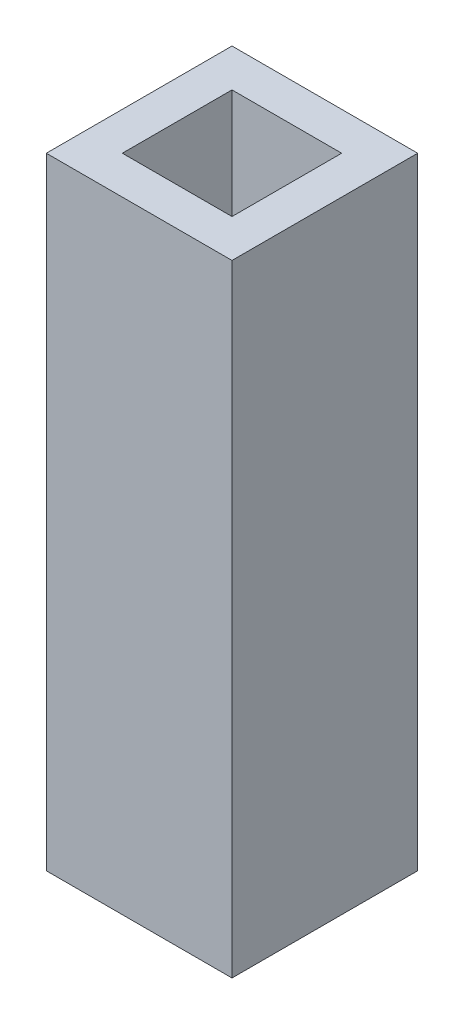
from build123d import *

# Parameters (mm, degrees)
SKETCH_1_W      = 2.54
SKETCH_1_H      = 2.54
SKETCH_1_W_2    = 1.5
SKETCH_1_H_2    = 1.5
EXTRUDE_1_DEPTH = 8.5


with BuildPart() as part:
    # Эскиз1 → Бобышка-Вытянуть1 (new body)
    with BuildSketch(Plane(origin=(0, 0, 0), x_dir=(1, 0, 0), z_dir=(0, 1, 0))):
        with Locations((1.27, 1.27)):
            Rectangle(SKETCH_1_W, SKETCH_1_H)
        with Locations((1.27, 1.27)):
            Rectangle(SKETCH_1_W_2, SKETCH_1_H_2, mode=Mode.SUBTRACT)
    extrude(amount=EXTRUDE_1_DEPTH)


solid = part.part
